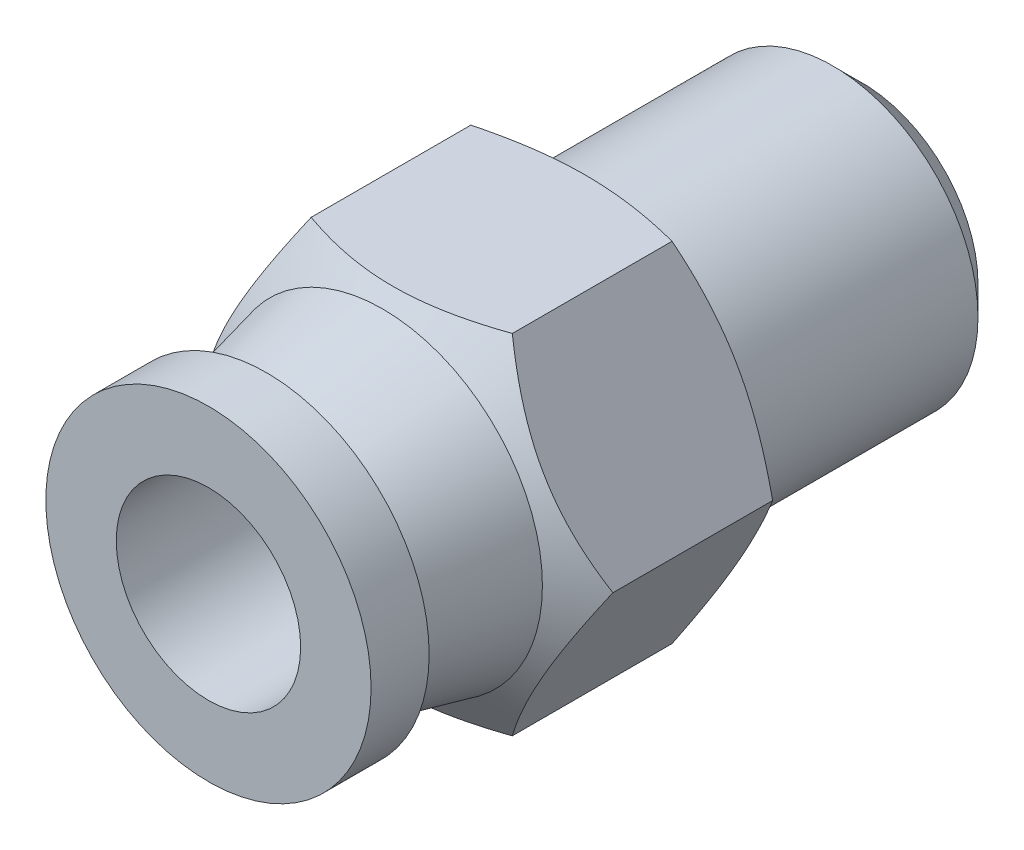
from build123d import *

# Parameters (mm, degrees)
SKETCH1_R           = 5
BOSS_EXTRUDE1_DEPTH = 9
BOSS_EXTRUDE2_DEPTH = 7.5
SKETCH3_R           = 5.5
BOSS_EXTRUDE3_DEPTH = 4
BOSS_EXTRUDE3_TAPER = 13
SKETCH4_R           = 5.6
BOSS_EXTRUDE4_DEPTH = 2
SKETCH5_R           = 3.175
CUT_EXTRUDE1_DEPTH  = 13
SKETCH6_R           = 2
CUT_EXTRUDE2_DEPTH  = 25.295061227
CHAMFER1_SIZE       = 1
CHAMFER2_SIZE       = 0.5


with BuildPart() as part:
    # Sketch1 → Boss-Extrude1 (new body)
    with BuildSketch(Plane.XY):
        Circle(SKETCH1_R)
    extrude(amount=BOSS_EXTRUDE1_DEPTH)

    # Sketch2 → Boss-Extrude2 (add)
    with BuildSketch(Plane.XY.offset(9)):
        Polygon((6.92820323, 0), (3.464101615, 6), (-3.464101615, 6), (-6.92820323, 0), (-3.464101615, -6), (3.464101615, -6), align=None)
    extrude(amount=BOSS_EXTRUDE2_DEPTH)

    # Sketch3 → Boss-Extrude3 (add)
    with BuildSketch(Plane.XY.offset(16.5)):
        Circle(SKETCH3_R)
    extrude(amount=BOSS_EXTRUDE3_DEPTH, taper=BOSS_EXTRUDE3_TAPER)

    # Sketch4 → Boss-Extrude4 (add)
    with BuildSketch(Plane.XY.offset(20.5)):
        Circle(SKETCH4_R)
    extrude(amount=BOSS_EXTRUDE4_DEPTH)

    # Sketch5 → Cut-Extrude1 (cut)
    with BuildSketch(Plane.XY.offset(22.5)):
        Circle(SKETCH5_R)
    extrude(amount=-CUT_EXTRUDE1_DEPTH, mode=Mode.SUBTRACT)

    # Sketch6 → Cut-Extrude2 (cut, through all)
    with BuildSketch(Plane(origin=(0, 0, 0), x_dir=(-1, 0, 0), z_dir=(0, 0, -1))):
        Circle(SKETCH6_R)
    extrude(amount=-CUT_EXTRUDE2_DEPTH, mode=Mode.SUBTRACT)

    # Sketch7 → Cut-Revolve1 (revolve, cut)
    with BuildSketch(Plane(origin=(0, 0, 0), x_dir=(1, 0, 0), z_dir=(0, 1, 0))):
        Polygon((5, -9), (6.92820323, -10), (6.92820323, -9), align=None)
        Polygon((6.92820323, -15.5), (6.92820323, -16.5), (5.5, -16.5), align=None)
    revolve(axis=Axis((0, 0, -1.125), (0, 0, 1)), mode=Mode.SUBTRACT)

    # Chamfer1
    chamfer1_edges = [part.edges().sort_by_distance(p)[0] for p in [
        (-5, 0, 0),
    ]]
    chamfer(chamfer1_edges, length=CHAMFER1_SIZE)

    # Chamfer2
    chamfer2_edges = [part.edges().sort_by_distance(p)[0] for p in [
        (2, 0, 0),
    ]]
    chamfer(chamfer2_edges, length=CHAMFER2_SIZE)


solid = part.part
